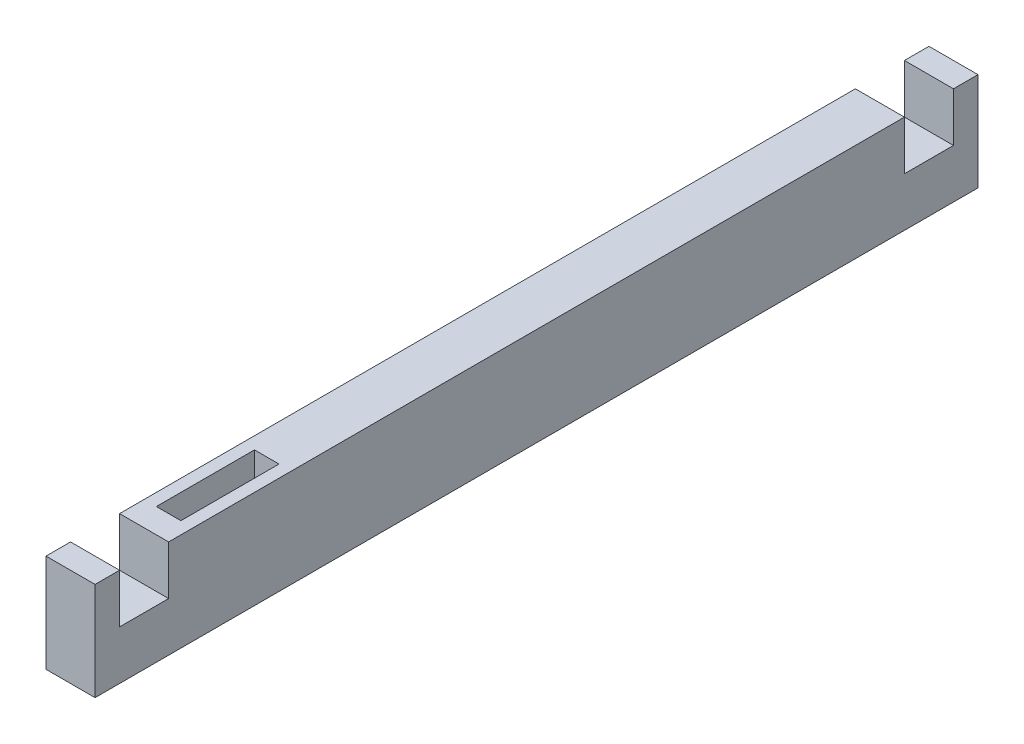
from build123d import *

# Parameters (mm, degrees)
SKETCH1_W           = 50.8
SKETCH1_H           = 101.6
BOSS_EXTRUDE1_DEPTH = 914.4
SKETCH2_W           = 50.8
SKETCH2_H           = 50.8
CUT_EXTRUDE1_DEPTH  = 918.217880332
SKETCH3_W           = 25.4
SKETCH3_H           = 101.6
CUT_EXTRUDE2_DEPTH  = 921.377683345


with BuildPart() as part:
    # Sketch1 → Boss-Extrude1 (new body)
    with BuildSketch(Plane.XY):
        Rectangle(SKETCH1_W, SKETCH1_H)
    extrude(amount=BOSS_EXTRUDE1_DEPTH)

    # Sketch2 → Cut-Extrude1 (cut, symmetric)
    with BuildSketch(Plane(origin=(25.4, 0, 0), x_dir=(0, 0, -1), z_dir=(1, 0, 0))):
        with Locations((304.8, 25.4)):
            Rectangle(SKETCH2_W, SKETCH2_H)
        with Locations((-863.6, 25.4)):
            Rectangle(SKETCH2_W, SKETCH2_H)
        with Locations((1473.2, 25.4)):
            Rectangle(SKETCH2_W, SKETCH2_H)
    cut_extrude1 = extrude(amount=CUT_EXTRUDE1_DEPTH, both=True, mode=Mode.SUBTRACT)

    # Mirror1: Cut-Extrude1 across plane
    add(cut_extrude1.mirror(Plane.XY.offset(457.2)), mode=Mode.SUBTRACT)

    # Sketch3 → Cut-Extrude2 (cut, through all)
    with BuildSketch(Plane(origin=(0, -50.8, 0), x_dir=(-1, 0, 0), z_dir=(0, -1, 0))):
        with Locations((0, -762)):
            Rectangle(SKETCH3_W, SKETCH3_H)
    extrude(amount=-CUT_EXTRUDE2_DEPTH, mode=Mode.SUBTRACT)


solid = part.part
